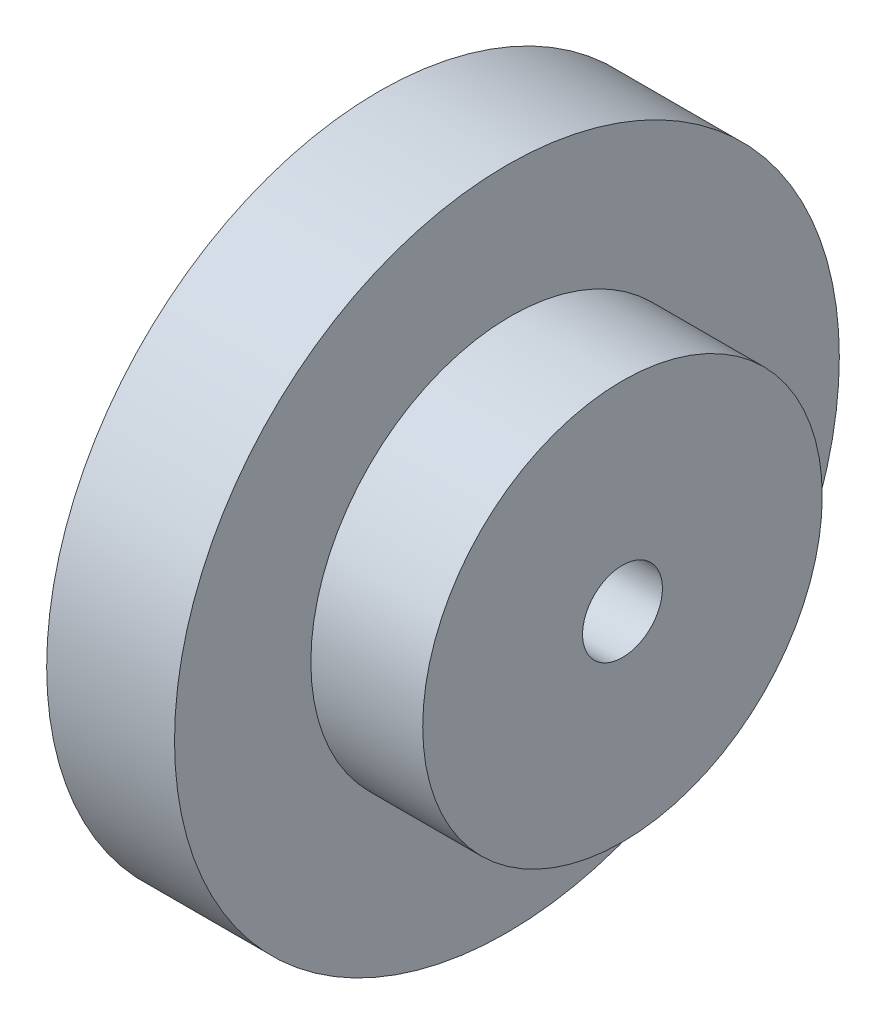
from build123d import *

# Parameters (mm, degrees)
SKETCH1_R           = 20.8
SKETCH1_R_2         = 2.5
BOSS_EXTRUDE1_DEPTH = 8
SKETCH2_R           = 12.5
SKETCH2_R_2         = 2.5
BOSS_EXTRUDE3_DEPTH = 7


with BuildPart() as part:
    # Sketch1 → Boss-Extrude1 (new body)
    with BuildSketch(Plane(origin=(0, 0, 0), x_dir=(0, 0, -1), z_dir=(1, 0, 0))):
        with Locations((0, -0.19719949)):
            Circle(SKETCH1_R)
        with Locations((0.230786774, -0.19719949)):
            Circle(SKETCH1_R_2, mode=Mode.SUBTRACT)
    extrude(amount=BOSS_EXTRUDE1_DEPTH)

    # Sketch2 → Boss-Extrude3 (add)
    with BuildSketch(Plane(origin=(8, 0, 0), x_dir=(0, 0, -1), z_dir=(1, 0, 0))):
        with Locations((0.230786774, -0.19719949)):
            Circle(SKETCH2_R)
        with Locations((0.230786774, -0.19719949)):
            Circle(SKETCH2_R_2, mode=Mode.SUBTRACT)
    extrude(amount=BOSS_EXTRUDE3_DEPTH)


solid = part.part
